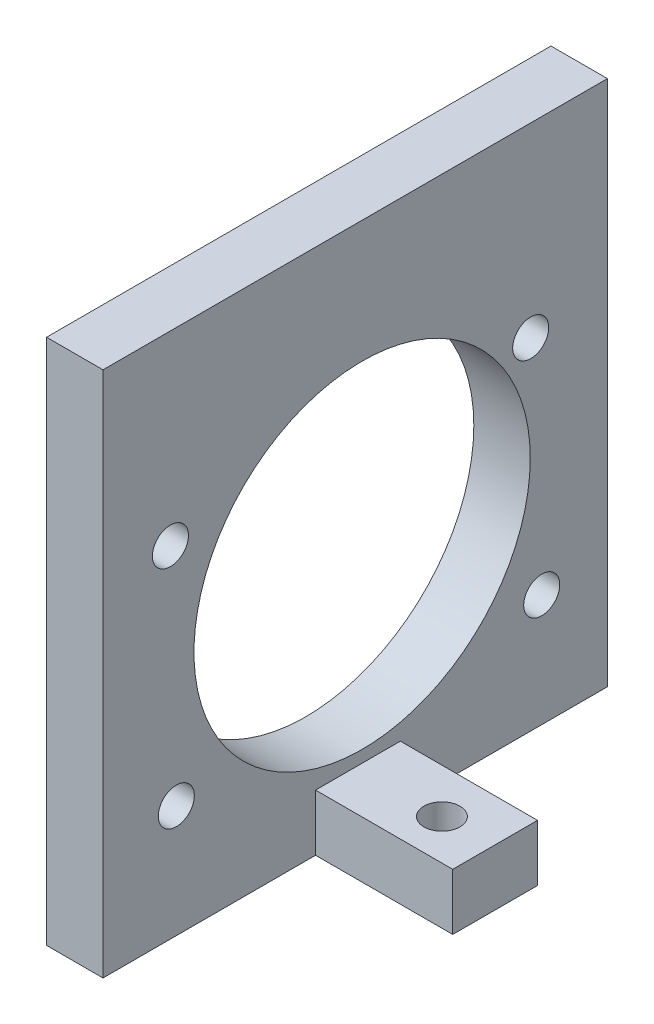
from build123d import *

# Parameters (mm, degrees)
EXTRUDE_THIN2_DEPTH = 42
SKETCH2_R           = 1.5
CUT_EXTRUDE1_DEPTH  = 60.728683855
SKETCH4_R           = 14
CUT_EXTRUDE3_DEPTH  = 60.728683855
SKETCH6_R           = 1.5
CUT_EXTRUDE5_DEPTH  = 60.728683855
SKETCH7_W           = 16.44057734
SKETCH7_H           = 17.698417135
SKETCH7_H_2         = 17.241848417
CUT_EXTRUDE6_DEPTH  = 60.728683855
SKETCH8_W           = 5.019650722
SKETCH8_H           = 7.059734448
CUT_EXTRUDE7_DEPTH  = 60.728683855


with BuildPart() as part:
    # Sketch1 → Extrude-Thin2 (new body)
    with BuildSketch(Plane.XY):
        Polygon((16.44057734, 0), (0, 0), (0, 39.156392732), (-4.7, 39.156392732), (-4.7, -4.7), (16.44057734, -4.7), align=None)
    extrude(amount=-EXTRUDE_THIN2_DEPTH)

    # Sketch2 → Cut-Extrude1 (cut, through all)
    with BuildSketch(Plane(origin=(0, 0, 0), x_dir=(1, 0, 0), z_dir=(0, 1, 0))):
        with Locations(Location((7.166226071, 21.052134807, 0), (0, 0, 270))):
            Circle(SKETCH2_R)
    extrude(amount=-CUT_EXTRUDE1_DEPTH, mode=Mode.SUBTRACT)

    # Sketch4 → Cut-Extrude3 (cut, through all)
    with BuildSketch(Plane(origin=(0, 0, 0), x_dir=(0, 0, -1), z_dir=(1, 0, 0))):
        with Locations((21.574999721, 14.995830113)):
            Circle(SKETCH4_R)
    extrude(amount=-CUT_EXTRUDE3_DEPTH, mode=Mode.SUBTRACT)

    # Sketch6 → Cut-Extrude5 (cut, through all)
    with BuildSketch(Plane(origin=(0, 0, 0), x_dir=(0, 0, -1), z_dir=(1, 0, 0))):
        with Locations((5.612051992, 23.659668557)):
            Circle(SKETCH6_R)
        with Locations((6.101337746, 4.659668557)):
            Circle(SKETCH6_R)
        with Locations((35.612051992, 23.659668557)):
            Circle(SKETCH6_R)
        with Locations((36.529462781, 4.659668557)):
            Circle(SKETCH6_R)
    extrude(amount=-CUT_EXTRUDE5_DEPTH, mode=Mode.SUBTRACT)

    # Sketch7 → Cut-Extrude6 (cut, through all)
    with BuildSketch(Plane(origin=(0, 0, 0), x_dir=(1, 0, 0), z_dir=(0, 1, 0))):
        with Locations((8.22028867, 8.849208567)):
            Rectangle(SKETCH7_W, SKETCH7_H)
        with Locations((8.22028867, 33.379075792)):
            Rectangle(SKETCH7_W, SKETCH7_H_2)
    extrude(amount=-CUT_EXTRUDE6_DEPTH, mode=Mode.SUBTRACT)

    # Sketch8 → Cut-Extrude7 (cut, through all)
    with BuildSketch(Plane(origin=(0, 0, 0), x_dir=(1, 0, 0), z_dir=(0, 1, 0))):
        with Locations((13.930751979, 21.228284359)):
            Rectangle(SKETCH8_W, SKETCH8_H)
    extrude(amount=-CUT_EXTRUDE7_DEPTH, mode=Mode.SUBTRACT)


solid = part.part
